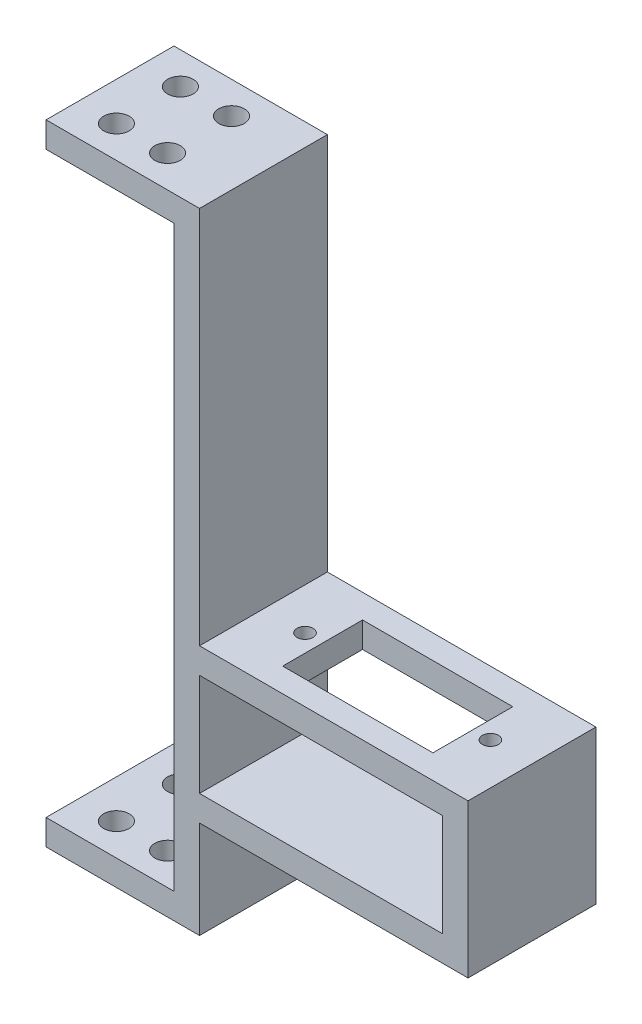
from build123d import *

# Parameters (mm, degrees)
BOSS_EXTRUDE1_DEPTH = 10
BOSS_EXTRUDE2_DEPTH = 20
SKETCH3_W           = 23.5
SKETCH3_H           = 12.5
CUT_EXTRUDE1_DEPTH  = 5
SKETCH4_R           = 1.25
CUT_EXTRUDE2_DEPTH  = 5
SKETCH5_R           = 2
CUT_EXTRUDE3_DEPTH  = 108.54650157


with BuildPart() as part:
    # Sketch1 → Boss-Extrude1 (new, symmetric)
    with BuildSketch(Plane.XY):
        Polygon((-24, 49.25), (0, 49.25), (0, -49.25), (-24, -49.25), (-24, -45.25), (-4, -45.25), (-4, 45.25), (-24, 45.25), align=None)
    extrude(amount=BOSS_EXTRUDE1_DEPTH, both=True)

    # Sketch2 → Boss-Extrude2 (add)
    with BuildSketch(Plane.XY.offset(10)):
        Polygon((0, -14), (38, -14), (38, -30), (0, -30), (0, -34), (42, -34), (42, -10), (0, -10), align=None)
    extrude(amount=-BOSS_EXTRUDE2_DEPTH)

    # Sketch3 → Cut-Extrude1 (cut)
    with BuildSketch(Plane(origin=(0, -10, 0), x_dir=(1, 0, 0), z_dir=(0, 1, 0))):
        with Locations((21, 0)):
            Rectangle(SKETCH3_W, SKETCH3_H)
    extrude(amount=-CUT_EXTRUDE1_DEPTH, mode=Mode.SUBTRACT)

    # Sketch4 → Cut-Extrude2 (cut)
    with BuildSketch(Plane(origin=(0, -10, 0), x_dir=(1, 0, 0), z_dir=(0, 1, 0))):
        with Locations(Location((35.5, 0, 0), (0, 0, 270))):
            Circle(SKETCH4_R)
        with Locations(Location((6.5, 0, 0), (0, 0, 270))):
            Circle(SKETCH4_R)
    extrude(amount=-CUT_EXTRUDE2_DEPTH, mode=Mode.SUBTRACT)

    # Sketch5 → Cut-Extrude3 (cut, through all)
    with BuildSketch(Plane(origin=(0, 49.25, 0), x_dir=(1, 0, 0), z_dir=(0, 1, 0))):
        with Locations(Location((-18, 5, 0), (0, 0, 180))):
            Circle(SKETCH5_R)
        with Locations(Location((-18, -5, 0), (0, 0, 180))):
            Circle(SKETCH5_R)
        with Locations(Location((-10, -5, 0), (0, 0, 180))):
            Circle(SKETCH5_R)
        with Locations(Location((-10, 5, 0), (0, 0, 180))):
            Circle(SKETCH5_R)
    extrude(amount=-CUT_EXTRUDE3_DEPTH, mode=Mode.SUBTRACT)


solid = part.part
